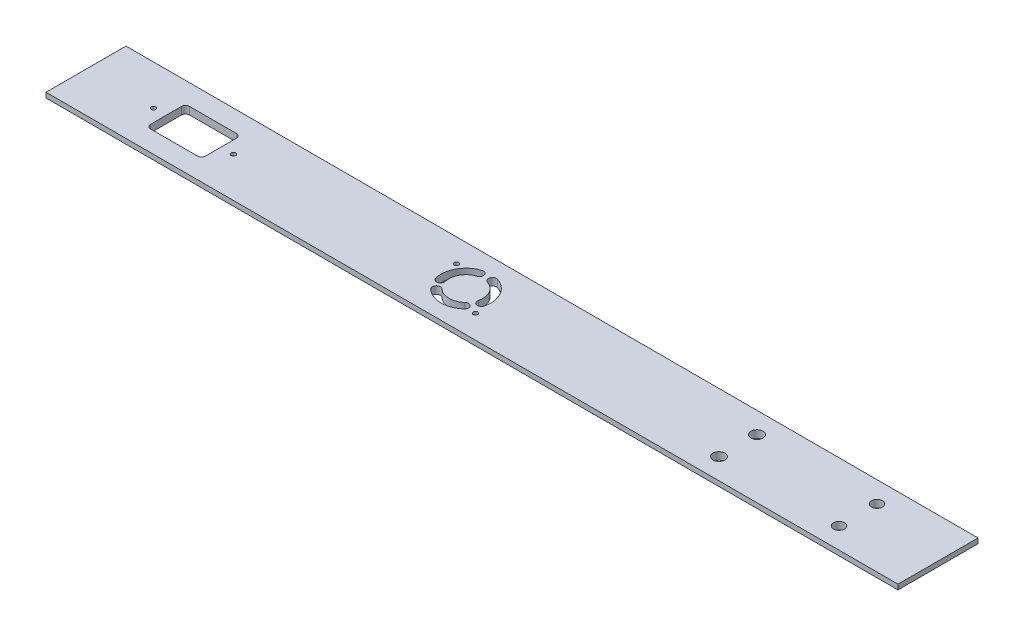
from build123d import *

# Parameters (mm, degrees)
SKETCH_1_W            = 426
SKETCH_1_H            = 40
EXTRUDE_1_DEPTH       = 3.7
SKETCH_1_2_W          = 426
SKETCH_1_2_H          = 40
SKETCH_1_2_W_2        = 422.8
SKETCH_1_2_H_2        = 36.8
CUT_EXTRUDE_1_DEPTH   = 1.2
SKETCH_2_R            = 2.75
SKETCH_2_R_2          = 1.15
SKETCH_2_R_3          = 3.006394209
SKETCH_2_W            = 27.5
SKETCH_2_H            = 19.5
CUT_EXTRUDE_1_2_DEPTH = 6
FILLET_1_R            = 2


with BuildPart() as part:
    # Эскиз1 → Бобышка-Вытянуть1 (new body)
    with BuildSketch(Plane(origin=(0, 0, 0), x_dir=(1, 0, 0), z_dir=(0, 1, 0))):
        Rectangle(SKETCH_1_W, SKETCH_1_H)
    extrude(amount=EXTRUDE_1_DEPTH)

    # Эскиз1<2> → Cut-Extrude 1 (cut)
    with BuildSketch(Plane(origin=(0, 0, 0), x_dir=(1, 0, 0), z_dir=(0, 1, 0))):
        Rectangle(SKETCH_1_2_W, SKETCH_1_2_H)
        Rectangle(SKETCH_1_2_W_2, SKETCH_1_2_H_2, mode=Mode.SUBTRACT)
    extrude(amount=CUT_EXTRUDE_1_DEPTH, mode=Mode.SUBTRACT)

    # Эскиз2 → Cut-Extrude 1 2 (cut)
    with BuildSketch(Plane(origin=(0, 0, 0), x_dir=(1, 0, 0), z_dir=(0, 1, 0))):
        with Locations((173, -9.5)):
            Circle(SKETCH_2_R)
        with Locations((173, 9.5)):
            Circle(SKETCH_2_R)
        with Locations((-179.25, 0)):
            Circle(SKETCH_2_R_2)
        with Locations((-139.25, 0)):
            Circle(SKETCH_2_R_2)
        with Locations((113, 9.5)):
            Circle(SKETCH_2_R_3)
        with Locations((113, -9.5)):
            Circle(SKETCH_2_R_3)
        with Locations((-9.9, -8.35)):
            Circle(SKETCH_2_R_2)
        with Locations((-36.1, 8.35)):
            Circle(SKETCH_2_R_2)
        with Locations((-159.25, 0)):
            Rectangle(SKETCH_2_W, SKETCH_2_H)
        with BuildLine():
            ThreePointArc((-10.861951827, -2.986266323), (-12.07669601, 6.077123492), (-19.13728757, 11.888206454))
            ThreePointArc((-19.13728757, 11.888206454), (-21.657434592, 10.60412741), (-20.373355548, 8.083980389))
            ThreePointArc((-20.373355548, 8.083980389), (-15.572153287, 4.132443975), (-14.746127242, -2.0306611))
            ThreePointArc((-14.746127242, -2.0306611), (-13.281842146, -4.450551419), (-10.861951827, -2.986266323))
        make_face()
        with BuildLine():
            ThreePointArc((-26.86271243, 11.888206454), (-33.92330399, 6.077123492), (-35.138048173, -2.986266323))
            ThreePointArc((-35.138048173, -2.986266323), (-32.718157854, -4.450551419), (-31.253872758, -2.0306611))
            ThreePointArc((-31.253872758, -2.0306611), (-30.427846713, 4.132443975), (-25.626644452, 8.083980389))
            ThreePointArc((-25.626644452, 8.083980389), (-24.342565408, 10.60412741), (-26.86271243, 11.888206454))
        make_face()
        with BuildLine():
            ThreePointArc((-31.609426427, -9.062437674), (-23.135416387, -12.499266475), (-14.588935276, -9.246836768))
            ThreePointArc((-14.588935276, -9.246836768), (-14.455211749, -6.421572529), (-17.280475988, -6.287849002))
            ThreePointArc((-17.280475988, -6.287849002), (-23.092083143, -8.499501203), (-28.854409971, -6.162457618))
            ThreePointArc((-28.854409971, -6.162457618), (-31.681908227, -6.234939418), (-31.609426427, -9.062437674))
        make_face()
    extrude(amount=CUT_EXTRUDE_1_2_DEPTH, mode=Mode.SUBTRACT)

    # Скругление1
    fillet_1_edges = [part.edges().sort_by_distance(p)[0] for p in [
        (-145.5, 1.85, 9.75),
        (-173, 1.85, 9.75),
        (-145.5, 1.85, -9.75),
        (-173, 1.85, -9.75),
    ]]
    fillet(fillet_1_edges, radius=FILLET_1_R)


solid = part.part
